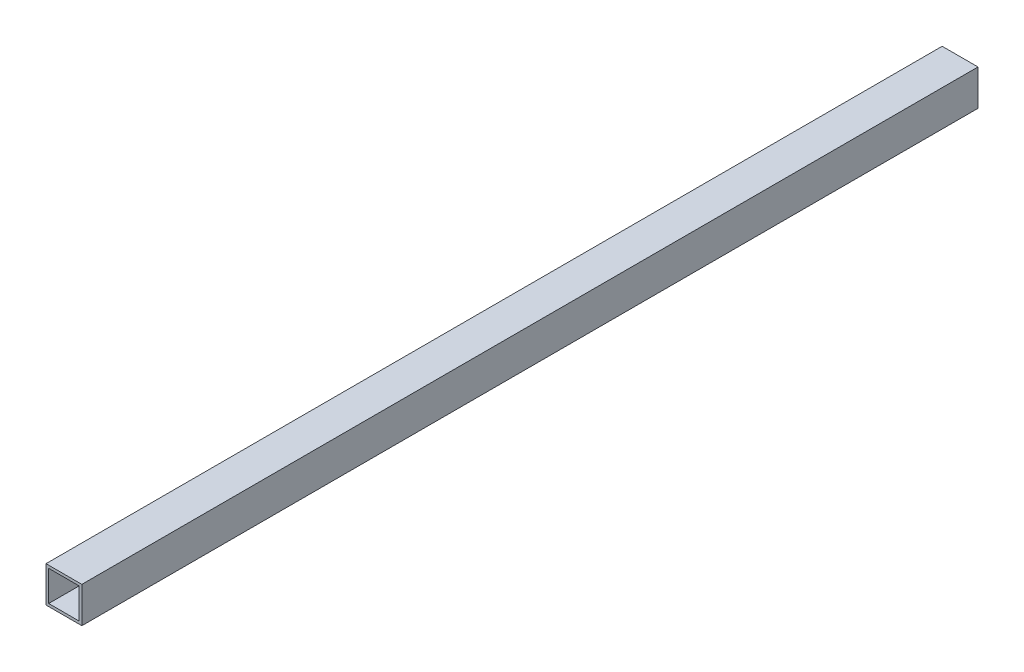
from build123d import *

# Parameters (mm, degrees)
SKETCH1_W           = 40
SKETCH1_H           = 40
BOSS_EXTRUDE1_DEPTH = 1000
SKETCH2_W           = 34
SKETCH2_H           = 34
CUT_EXTRUDE1_DEPTH  = 1000


with BuildPart() as part:
    # Sketch1 → Boss-Extrude1 (new body)
    with BuildSketch(Plane.XY):
        Rectangle(SKETCH1_W, SKETCH1_H)
    extrude(amount=BOSS_EXTRUDE1_DEPTH)

    # Sketch2 → Cut-Extrude1 (cut)
    with BuildSketch(Plane(origin=(0, 0, 0), x_dir=(-1, 0, 0), z_dir=(0, 0, -1))):
        Rectangle(SKETCH2_W, SKETCH2_H)
    extrude(amount=-CUT_EXTRUDE1_DEPTH, mode=Mode.SUBTRACT)


solid = part.part
